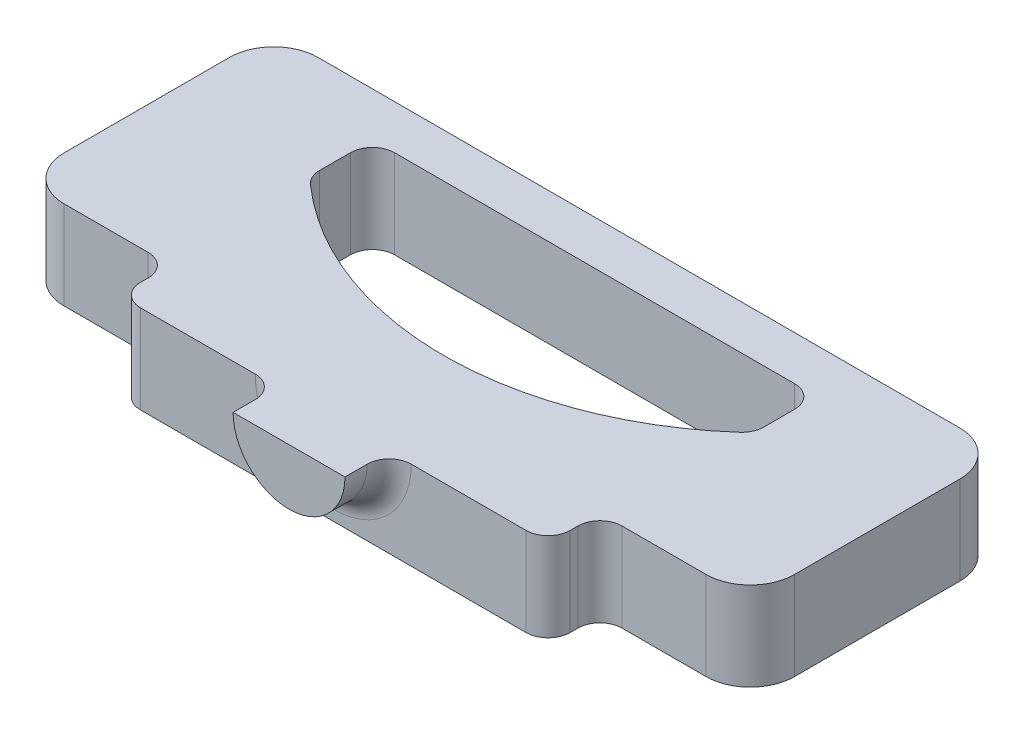
from build123d import *

# Parameters (mm, degrees)
EXTRUDE1_DEPTH = 12.7
EXTRUDE2_DEPTH = 6.35
FILLET1_R      = 3.175


with BuildPart() as part:
    # Sketch1 → Extrude1 (new body)
    with BuildSketch(Plane(origin=(0, 0, 0), x_dir=(1, 0, 0), z_dir=(0, 1, 0))):
        with BuildLine():
            Line((0, 30.076477833), (0, 6.35))
            ThreePointArc((0, 6.35), (1.859871939, 1.859871939), (6.35, 0))
            Line((6.35, 0), (18.40185504, 0))
            ThreePointArc((18.40185504, 0), (20.64691907, -0.92993597), (21.57685504, -3.175))
            Line((21.57685504, -3.175), (21.57685504, -4.269827586))
            ThreePointArc((21.57685504, -4.269827586), (22.506791009, -6.514891616), (24.75185504, -7.444827586))
            Line((24.75185504, -7.444827586), (80.087569325, -7.444827586))
            ThreePointArc((80.087569325, -7.444827586), (82.332633356, -6.514891616), (83.262569325, -4.269827586))
            Line((83.262569325, -4.269827586), (83.262569325, -3.175))
            ThreePointArc((83.262569325, -3.175), (84.192505295, -0.92993597), (86.437569325, 0))
            Line((86.437569325, 0), (98.489424365, 0))
            ThreePointArc((98.489424365, 0), (102.979552425, 1.859871939), (104.839424365, 6.35))
            Line((104.839424365, 6.35), (104.839424365, 30.076477833))
            ThreePointArc((104.839424365, 30.076477833), (102.979552425, 34.566605893), (98.489424365, 36.426477833))
            Line((98.489424365, 36.426477833), (6.35, 36.426477833))
            ThreePointArc((6.35, 36.426477833), (1.859871939, 34.566605893), (0, 30.076477833))
        make_face()
        with BuildLine():
            Line((81.136140344, 30.076477833), (23.703284021, 30.076477833))
            ThreePointArc((23.703284021, 30.076477833), (21.458219991, 29.146541863), (20.528284021, 26.901477833))
            Line((20.528284021, 26.901477833), (20.528284021, 22.476973979))
            ThreePointArc((20.528284021, 22.476973979), (20.807016141, 21.176106051), (21.594272913, 20.103643587))
            ThreePointArc((21.594272913, 20.103643587), (52.419712182, 8.386390066), (83.245151452, 20.103643587))
            ThreePointArc((83.245151452, 20.103643587), (84.032408224, 21.176106051), (84.311140344, 22.476973979))
            Line((84.311140344, 22.476973979), (84.311140344, 26.901477833))
            ThreePointArc((84.311140344, 26.901477833), (83.381204374, 29.146541863), (81.136140344, 30.076477833))
        make_face(mode=Mode.SUBTRACT)
    extrude(amount=-EXTRUDE1_DEPTH)

    # Sketch2 → Extrude2 (add)
    with BuildSketch(Plane.XY.offset(7.444827586)):
        with BuildLine():
            Line((44.389946351, 0), (60.449478013, 0))
            ThreePointArc((60.449478013, 0), (52.419712182, -8.029765831), (44.389946351, 0))
        make_face()
    extrude(amount=EXTRUDE2_DEPTH)

    # Fillet1
    fillet1_edges = [part.edges().sort_by_distance(p)[0] for p in [
        (52.419712182, -8.029765831, 7.444827586),
    ]]
    fillet(fillet1_edges, radius=FILLET1_R)


solid = part.part
